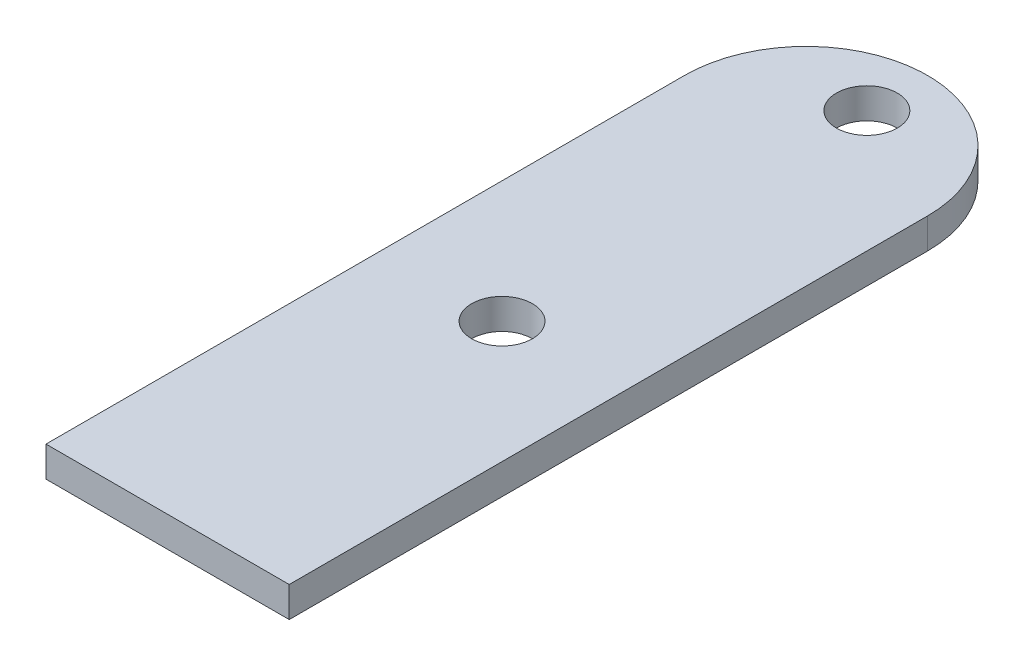
from build123d import *

# Parameters (mm, degrees)
SKETCH1_W           = 25.4
SKETCH1_H           = 79.375
SKETCH1_R           = 3.175
BOSS_EXTRUDE1_DEPTH = 3.175
FILLET1_RADIUS      = 12.7
FILLET1_LENGTH      = 3.175


with BuildPart() as part:
    # Sketch1 → Boss-Extrude1 (new body)
    with BuildSketch(Plane(origin=(0, 0, 0), x_dir=(1, 0, 0), z_dir=(0, 1, 0))):
        with Locations((12.7, 39.6875)):
            Rectangle(SKETCH1_W, SKETCH1_H)
        with Locations(Location((12.7, 73.025, 0), (0, 0, 270))):
            Circle(SKETCH1_R, mode=Mode.SUBTRACT)
        with Locations(Location((12.7, 34.925, 0), (0, 0, 270))):
            Circle(SKETCH1_R, mode=Mode.SUBTRACT)
    extrude(amount=BOSS_EXTRUDE1_DEPTH)

    # Fillet1: full round fillet: the end face becomes a half cylinder, R = half its width
    fillet1_face = Plane((12.7, 1.5875, -79.375), x_dir=(0, 1, 0), z_dir=(0, 0, -1))  # on the end face: x along it, z out of the body
    fillet1_slab = fillet1_face.offset(-FILLET1_RADIUS / 2) * Box(FILLET1_LENGTH, 2 * FILLET1_RADIUS, FILLET1_RADIUS, mode=Mode.PRIVATE)  # the body's end, R deep
    fillet1_round = Plane((12.7, 1.5875, -66.675), x_dir=(0, 0, -1), z_dir=(0, 1, 0)) * Cylinder(FILLET1_RADIUS, FILLET1_LENGTH, mode=Mode.PRIVATE)  # its axis R under the face
    add(fillet1_slab - fillet1_round, mode=Mode.SUBTRACT)


solid = part.part
